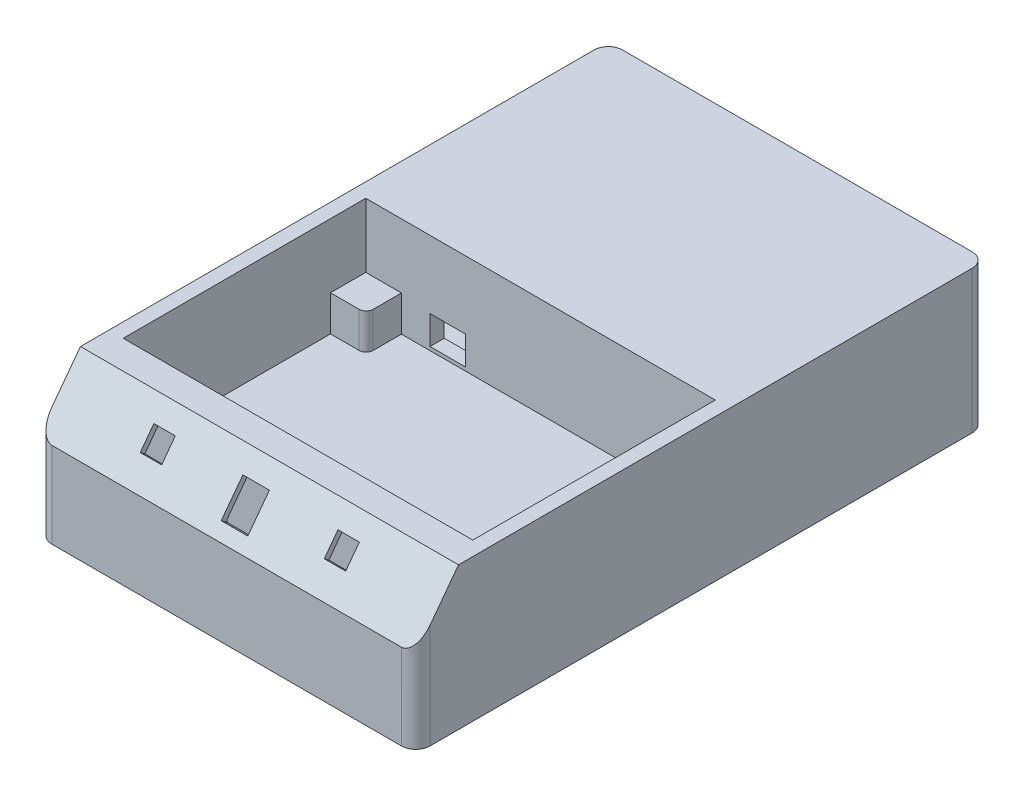
from build123d import *

# Parameters (mm, degrees)
BOSS_EXTRUDE2_DEPTH      = 100
SKETCH4_W                = 245
SKETCH4_H                = 170
CUT_EXTRUDE2_DEPTH       = 70
CUT_EXTRUDE12_DEPTH      = 434.077648927
CUT_EXTRUDE12_DEPTH_BACK = 434.077648927
CUT_EXTRUDE13_DEPTH      = 122.5
CUT_EXTRUDE14_DEPTH      = 122.5
SKETCH16_W               = 43.138722299
SKETCH16_H               = 40.379444726
CUT_EXTRUDE15_DEPTH      = 30
SKETCH17_W               = 15
SKETCH17_H               = 16
SKETCH17_W_2             = 18.622276722
SKETCH17_H_2             = 25.273514742
CUT_EXTRUDE16_DEPTH      = 10
BOSS_EXTRUDE3_DEPTH      = 25
SKETCH19_W               = 25
SKETCH19_H               = 20
CUT_EXTRUDE17_DEPTH      = 15


with BuildPart() as part:
    # Sketch1 → Boss-Extrude2 (new body)
    with BuildSketch(Plane(origin=(0, 0, 0), x_dir=(1, 0, 0), z_dir=(0, 1, 0))):
        with BuildLine():
            Line((0, -10), (0, -390))
            ThreePointArc((0, -390), (2.928932188, -397.071067812), (10, -400))
            Line((10, -400), (255, -400))
            ThreePointArc((255, -400), (262.071067812, -397.071067812), (265, -390))
            Line((265, -390), (265, -10))
            ThreePointArc((265, -10), (262.071067812, -2.928932188), (255, 0))
            Line((255, 0), (10, 0))
            ThreePointArc((10, 0), (2.928932188, -2.928932188), (0, -10))
        make_face()
    extrude(amount=BOSS_EXTRUDE2_DEPTH)

    # Sketch4 → Cut-Extrude2 (cut)
    with BuildSketch(Plane(origin=(0, 100, 0), x_dir=(1, 0, 0), z_dir=(0, 1, 0))):
        with Locations((132.5, -265)):
            Rectangle(SKETCH4_W, SKETCH4_H)
    extrude(amount=-CUT_EXTRUDE2_DEPTH, mode=Mode.SUBTRACT)

    # Sketch10 → Cut-Extrude12 (cut, two sides: drawn at the far end of the back side and taken through both)
    with BuildSketch(Plane(origin=(132.5, 0, 0), x_dir=(0, 0, -1), z_dir=(1, 0, 0)).offset(-CUT_EXTRUDE12_DEPTH_BACK)):
        Polygon((-400, 60), (-370, 100), (-400, 100), align=None)
    extrude(amount=CUT_EXTRUDE12_DEPTH + CUT_EXTRUDE12_DEPTH_BACK, mode=Mode.SUBTRACT)

    # Sketch14 → Cut-Extrude13 (cut, symmetric)
    with BuildSketch(Plane(origin=(132.5, 0, 0), x_dir=(0, 0, -1), z_dir=(1, 0, 0))):
        Polygon((-390, 10), (-360, 10), (-360, 96), (-368, 96), (-390, 66.666666667), align=None)
    extrude(amount=CUT_EXTRUDE13_DEPTH, both=True, mode=Mode.SUBTRACT)

    # Sketch15 → Cut-Extrude14 (cut, symmetric)
    with BuildSketch(Plane(origin=(132.5, 0, 0), x_dir=(0, 0, -1), z_dir=(1, 0, 0))):
        Polygon((-360, 9.784104138), (-360, 20), (-170, 20), (-170, 95), (-15, 95), (-15, 10), align=None)
    extrude(amount=CUT_EXTRUDE14_DEPTH, both=True, mode=Mode.SUBTRACT)

    # Sketch16 → Cut-Extrude15 (cut)
    with BuildSketch(Plane(origin=(0, 0, 0), x_dir=(-1, 0, 0), z_dir=(0, 0, -1))):
        with BuildLine():
            Line((-240.140690251, 79.23821095), (-190.467776295, 79.23821095))
            ThreePointArc((-190.467776295, 79.23821095), (-188.532467959, 77.302902614), (-190.467776295, 75.367594278))
            Line((-190.467776295, 75.367594278), (-240.140690251, 75.367594278))
            ThreePointArc((-240.140690251, 75.367594278), (-242.075998587, 77.302902614), (-240.140690251, 79.23821095))
        make_face()
        with BuildLine():
            Line((-183.801714249, 79.23821095), (-136.494177148, 79.23821095))
            ThreePointArc((-136.494177148, 79.23821095), (-134.558868812, 77.302902614), (-136.494177148, 75.367594278))
            Line((-136.494177148, 75.367594278), (-183.801714249, 75.367594278))
            ThreePointArc((-183.801714249, 75.367594278), (-185.737022585, 77.302902614), (-183.801714249, 79.23821095))
        make_face()
        with BuildLine():
            Line((-239.932606186, 72.357114645), (-190.25969223, 72.357114645))
            ThreePointArc((-190.25969223, 72.357114645), (-188.324383894, 70.421806309), (-190.25969223, 68.486497973))
            Line((-190.25969223, 68.486497973), (-239.932606186, 68.486497973))
            ThreePointArc((-239.932606186, 68.486497973), (-241.867914521, 70.421806309), (-239.932606186, 72.357114645))
        make_face()
        with BuildLine():
            Line((-183.593630184, 72.357114645), (-136.286093083, 72.357114645))
            ThreePointArc((-136.286093083, 72.357114645), (-134.350784747, 70.421806309), (-136.286093083, 68.486497973))
            Line((-136.286093083, 68.486497973), (-183.593630184, 68.486497973))
            ThreePointArc((-183.593630184, 68.486497973), (-185.52893852, 70.421806309), (-183.593630184, 72.357114645))
        make_face()
        with BuildLine():
            Line((-239.825089056, 65.476018339), (-190.1521751, 65.476018339))
            ThreePointArc((-190.1521751, 65.476018339), (-188.216866764, 63.540710003), (-190.1521751, 61.605401667))
            Line((-190.1521751, 61.605401667), (-239.825089056, 61.605401667))
            ThreePointArc((-239.825089056, 61.605401667), (-241.760397392, 63.540710003), (-239.825089056, 65.476018339))
        make_face()
        with BuildLine():
            Line((-183.486113054, 65.476018339), (-136.178575953, 65.476018339))
            ThreePointArc((-136.178575953, 65.476018339), (-134.243267617, 63.540710003), (-136.178575953, 61.605401667))
            Line((-136.178575953, 61.605401667), (-183.486113054, 61.605401667))
            ThreePointArc((-183.486113054, 61.605401667), (-185.42142139, 63.540710003), (-183.486113054, 65.476018339))
        make_face()
        with BuildLine():
            Line((-239.617004991, 58.594922033), (-189.944091035, 58.594922033))
            ThreePointArc((-189.944091035, 58.594922033), (-188.008782699, 56.659613697), (-189.944091035, 54.724305362))
            Line((-189.944091035, 54.724305362), (-239.617004991, 54.724305362))
            ThreePointArc((-239.617004991, 54.724305362), (-241.552313326, 56.659613697), (-239.617004991, 58.594922033))
        make_face()
        with BuildLine():
            Line((-183.278028989, 58.594922033), (-135.970491888, 58.594922033))
            ThreePointArc((-135.970491888, 58.594922033), (-134.035183552, 56.659613697), (-135.970491888, 54.724305362))
            Line((-135.970491888, 54.724305362), (-183.278028989, 54.724305362))
            ThreePointArc((-183.278028989, 54.724305362), (-185.213337325, 56.659613697), (-183.278028989, 58.594922033))
        make_face()
        with BuildLine():
            Line((-239.918705797, 44.187626644), (-190.245791841, 44.187626644))
            ThreePointArc((-190.245791841, 44.187626644), (-188.310483505, 42.252318308), (-190.245791841, 40.317009972))
            Line((-190.245791841, 40.317009972), (-239.918705797, 40.317009972))
            ThreePointArc((-239.918705797, 40.317009972), (-241.854014133, 42.252318308), (-239.918705797, 44.187626644))
        make_face()
        with BuildLine():
            Line((-183.579729795, 44.187626644), (-136.272192694, 44.187626644))
            ThreePointArc((-136.272192694, 44.187626644), (-134.336884358, 42.252318308), (-136.272192694, 40.317009972))
            Line((-136.272192694, 40.317009972), (-183.579729795, 40.317009972))
            ThreePointArc((-183.579729795, 40.317009972), (-185.515038131, 42.252318308), (-183.579729795, 44.187626644))
        make_face()
        with BuildLine():
            Line((-239.710621732, 37.306530338), (-190.037707776, 37.306530338))
            ThreePointArc((-190.037707776, 37.306530338), (-188.10239944, 35.371222002), (-190.037707776, 33.435913666))
            Line((-190.037707776, 33.435913666), (-239.710621732, 33.435913666))
            ThreePointArc((-239.710621732, 33.435913666), (-241.645930068, 35.371222002), (-239.710621732, 37.306530338))
        make_face()
        with BuildLine():
            Line((-183.37164573, 37.306530338), (-136.064108629, 37.306530338))
            ThreePointArc((-136.064108629, 37.306530338), (-134.128800293, 35.371222002), (-136.064108629, 33.435913666))
            Line((-136.064108629, 33.435913666), (-183.37164573, 33.435913666))
            ThreePointArc((-183.37164573, 33.435913666), (-185.306954066, 35.371222002), (-183.37164573, 37.306530338))
        make_face()
        with BuildLine():
            Line((-239.603104602, 30.425434033), (-189.930190646, 30.425434033))
            ThreePointArc((-189.930190646, 30.425434033), (-187.99488231, 28.490125697), (-189.930190646, 26.554817361))
            Line((-189.930190646, 26.554817361), (-239.603104602, 26.554817361))
            ThreePointArc((-239.603104602, 26.554817361), (-241.538412938, 28.490125697), (-239.603104602, 30.425434033))
        make_face()
        with BuildLine():
            Line((-183.2641286, 30.425434033), (-135.956591499, 30.425434033))
            ThreePointArc((-135.956591499, 30.425434033), (-134.021283163, 28.490125697), (-135.956591499, 26.554817361))
            Line((-135.956591499, 26.554817361), (-183.2641286, 26.554817361))
            ThreePointArc((-183.2641286, 26.554817361), (-185.199436936, 28.490125697), (-183.2641286, 30.425434033))
        make_face()
        with BuildLine():
            Line((-239.395020537, 23.544337727), (-189.722106581, 23.544337727))
            ThreePointArc((-189.722106581, 23.544337727), (-187.786798245, 21.609029391), (-189.722106581, 19.673721055))
            Line((-189.722106581, 19.673721055), (-239.395020537, 19.673721055))
            ThreePointArc((-239.395020537, 19.673721055), (-241.330328873, 21.609029391), (-239.395020537, 23.544337727))
        make_face()
        with BuildLine():
            Line((-183.056044535, 23.544337727), (-135.748507434, 23.544337727))
            ThreePointArc((-135.748507434, 23.544337727), (-133.813199098, 21.609029391), (-135.748507434, 19.673721055))
            Line((-135.748507434, 19.673721055), (-183.056044535, 19.673721055))
            ThreePointArc((-183.056044535, 19.673721055), (-184.991352871, 21.609029391), (-183.056044535, 23.544337727))
        make_face()
        with Locations((-62.397436661, 30.189722363)):
            Rectangle(SKETCH16_W, SKETCH16_H)
    extrude(amount=-CUT_EXTRUDE15_DEPTH, mode=Mode.SUBTRACT)

    # Sketch17 → Cut-Extrude16 (cut)
    with BuildSketch(Plane(origin=(0, 213.6, 284.8), x_dir=(1, 0, 0), z_dir=(0, 0.5999999999999998, 0.8000000000000004))):
        with Locations((68, -165)):
            Rectangle(SKETCH17_W, SKETCH17_H)
        with Locations((197, -165)):
            Rectangle(SKETCH17_W, SKETCH17_H)
        with Locations((132.148099668, -169.636757371)):
            Rectangle(SKETCH17_W_2, SKETCH17_H_2)
    extrude(amount=-CUT_EXTRUDE16_DEPTH, mode=Mode.SUBTRACT)

    # Sketch18 → Boss-Extrude3 (add)
    with BuildSketch(Plane(origin=(0, 30, 0), x_dir=(1, 0, 0), z_dir=(0, 1, 0))):
        with BuildLine():
            Line((10, -180), (10, -204.729927007))
            Line((10, -204.729927007), (30, -204.729927007))
            ThreePointArc((30, -204.729927007), (33.43872324, -203.359690427), (34.99270073, -200))
            Line((34.99270073, -200), (34.99270073, -180))
            Line((34.99270073, -180), (10, -180))
        make_face()
        with BuildLine():
            Line((255, -350), (255, -324.14910859))
            Line((255, -324.14910859), (235, -324.14910859))
            ThreePointArc((235, -324.14910859), (231.175444009, -325.928429861), (230.072933549, -330))
            Line((230.072933549, -330), (230.072933549, -350))
            Line((230.072933549, -350), (255, -350))
        make_face()
    extrude(amount=BOSS_EXTRUDE3_DEPTH)

    # Sketch19 → Cut-Extrude17 (cut)
    with BuildSketch(Plane.XY.offset(180)):
        with Locations((67.49270073, 42.5)):
            Rectangle(SKETCH19_W, SKETCH19_H)
    extrude(amount=-CUT_EXTRUDE17_DEPTH, mode=Mode.SUBTRACT)


solid = part.part
